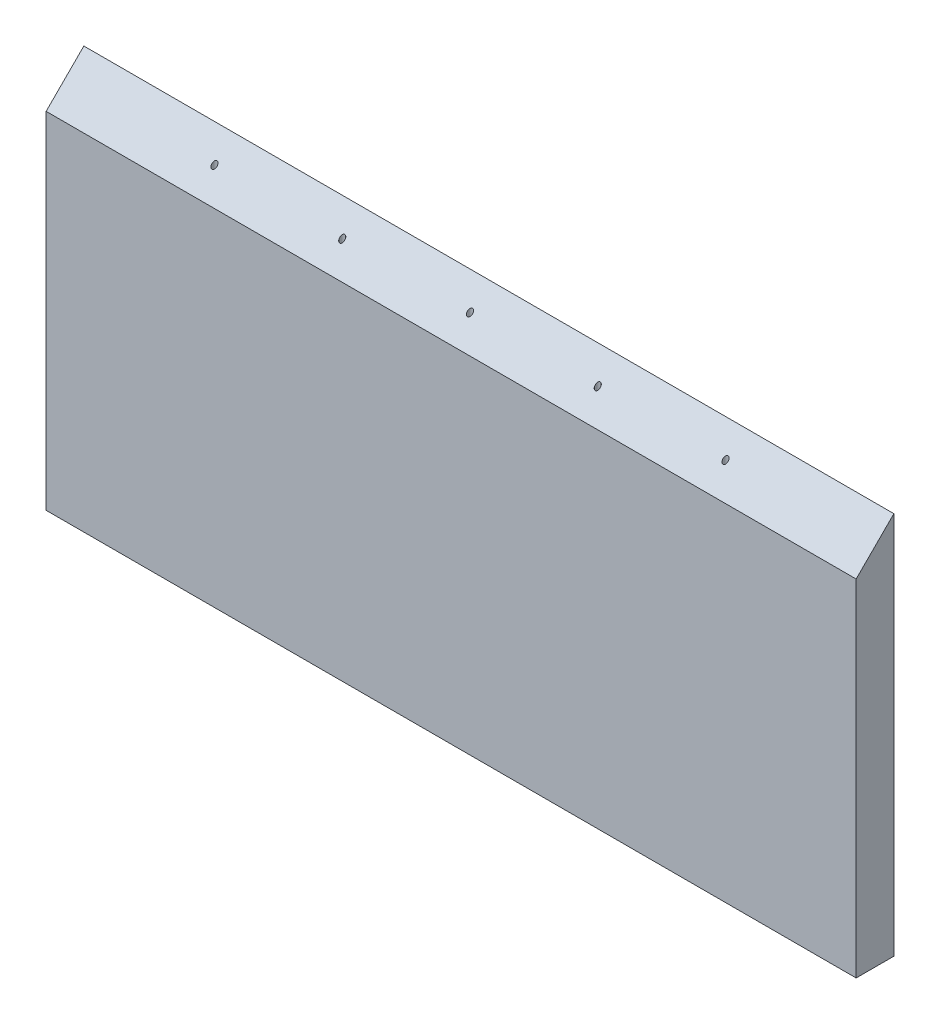
from build123d import *

# Parameters (mm, degrees)
SKETCH_1_W          = 322.1
SKETCH_1_H          = 152.4
EXTRUDE_1_DEPTH     = 15
CUT_EXTRUDE_START   = 152.4
SKETCH_2_R          = 1
CUT_EXTRUDE_1_DEPTH = 50.8
CUT_EXTRUDE_2_DEPTH = 357.649926398


with BuildPart() as part:
    # 草图1 → 凸台-拉伸1 (new body)
    with BuildSketch(Plane.XY):
        with Locations((161.05, 76.2)):
            Rectangle(SKETCH_1_W, SKETCH_1_H)
    extrude(amount=EXTRUDE_1_DEPTH)

    # 草图2 → 切除-拉伸1 (cut)
    with BuildSketch(Plane(origin=(0, 0, 0), x_dir=(1, 0, 0), z_dir=(0, 1, 0)).offset(CUT_EXTRUDE_START)):
        with Locations(Location((161.05, -7.5, 0), (0, 0, 90))):
            Circle(SKETCH_2_R)
        with Locations(Location((211.85, -7.5, 0), (0, 0, 90))):
            Circle(SKETCH_2_R)
        with Locations(Location((262.65, -7.5, 0), (0, 0, 90))):
            Circle(SKETCH_2_R)
        with Locations(Location((110.25, -7.5, 0), (0, 0, 90))):
            Circle(SKETCH_2_R)
        with Locations(Location((59.45, -7.5, 0), (0, 0, 90))):
            Circle(SKETCH_2_R)
    extrude(amount=-CUT_EXTRUDE_1_DEPTH, mode=Mode.SUBTRACT)

    # 草图3 → 切除-拉伸2 (cut, through all)
    with BuildSketch(Plane.ZY):
        Polygon((0, 152.4), (15, 137.4), (15, 152.4), align=None)
    extrude(amount=-CUT_EXTRUDE_2_DEPTH, mode=Mode.SUBTRACT)


solid = part.part
